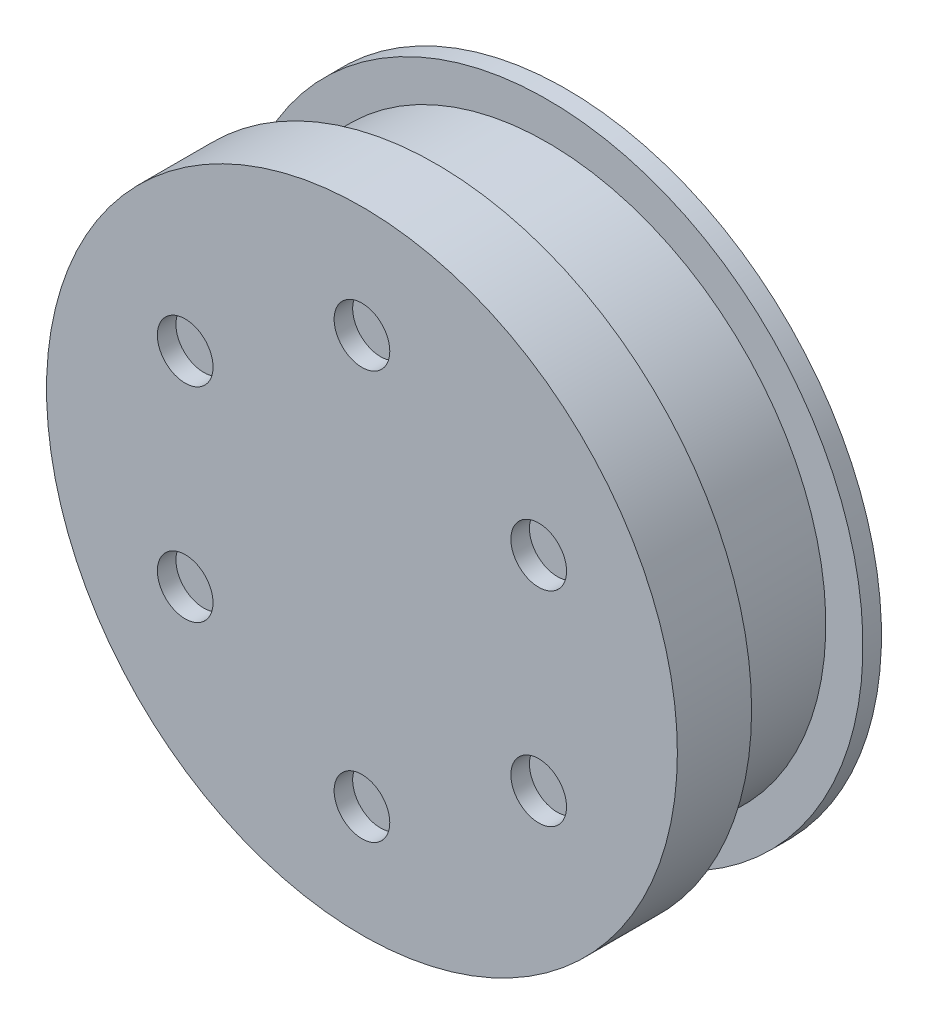
from build123d import *

# Parameters (mm, degrees)
SKETCH_1_R          = 15
EXTRUDE_1_DEPTH     = 8
SKETCH_2_R          = 17
SKETCH_2_R_2        = 15
EXTRUDE_2_DEPTH     = 1
SKETCH_3_R          = 1.5
CUT_EXTRUDE_1_DEPTH = 26.337718919
EXTRUDE_START       = -1
SKETCH_4_R          = 17
SKETCH_4_R_2        = 15
EXTRUDE_3_DEPTH     = 1
SKETCH_5_R          = 17
EXTRUDE_4_DEPTH     = 3
SKETCH_6_R          = 1.5
CUT_EXTRUDE_6_DEPTH = 1


with BuildPart() as part:
    # 草图1 → 凸台-拉伸1 (new body)
    with BuildSketch(Plane.XY):
        Circle(SKETCH_1_R)
    extrude(amount=EXTRUDE_1_DEPTH)

    # 草图2 → 凸台-拉伸2 (add)
    with BuildSketch(Plane(origin=(0, 0, 0), x_dir=(-1, 0, 0), z_dir=(0, 0, -1))):
        Circle(SKETCH_2_R)
        Circle(SKETCH_2_R_2, mode=Mode.SUBTRACT)
    extrude(amount=-EXTRUDE_2_DEPTH)

    # 草图3 → 切除-拉伸1 (cut, through all)
    with BuildSketch(Plane.XY.offset(8)):
        with Locations((0, 11)):
            Circle(SKETCH_3_R)
        with Locations((9.526279442, 5.5)):
            Circle(SKETCH_3_R)
        with Locations((9.526279442, -5.5)):
            Circle(SKETCH_3_R)
        with Locations((0, -11)):
            Circle(SKETCH_3_R)
        with Locations((-9.526279442, -5.5)):
            Circle(SKETCH_3_R)
        with Locations((-9.526279442, 5.5)):
            Circle(SKETCH_3_R)
    extrude(amount=-CUT_EXTRUDE_1_DEPTH, mode=Mode.SUBTRACT)

    # 草图4 → 凸台-拉伸3 (add)
    with BuildSketch(Plane.XY.offset(8).offset(EXTRUDE_START)):
        with Locations(Location((0, 0, 0), (0, 0, 180))):
            Circle(SKETCH_4_R)
        with Locations(Location((0, 0, 0), (0, 0, 180))):
            Circle(SKETCH_4_R_2, mode=Mode.SUBTRACT)
    extrude(amount=EXTRUDE_3_DEPTH)

    # 草图5 → 凸台-拉伸4 (add)
    with BuildSketch(Plane.XY.offset(8)):
        with Locations(Location((0, 0, 0), (0, 0, 180))):
            Circle(SKETCH_5_R)
    extrude(amount=EXTRUDE_4_DEPTH)

    # 草图6 → 切除-拉伸6 (cut)
    with BuildSketch(Plane.XY.offset(11)):
        with Locations((0, 11)):
            Circle(SKETCH_6_R)
        with Locations((9.526279442, 5.5)):
            Circle(SKETCH_6_R)
        with Locations((9.526279442, -5.5)):
            Circle(SKETCH_6_R)
        with Locations((0, -11)):
            Circle(SKETCH_6_R)
        with Locations((-9.526279442, -5.5)):
            Circle(SKETCH_6_R)
        with Locations((-9.526279442, 5.5)):
            Circle(SKETCH_6_R)
    extrude(amount=-CUT_EXTRUDE_6_DEPTH, mode=Mode.SUBTRACT)


solid = part.part
